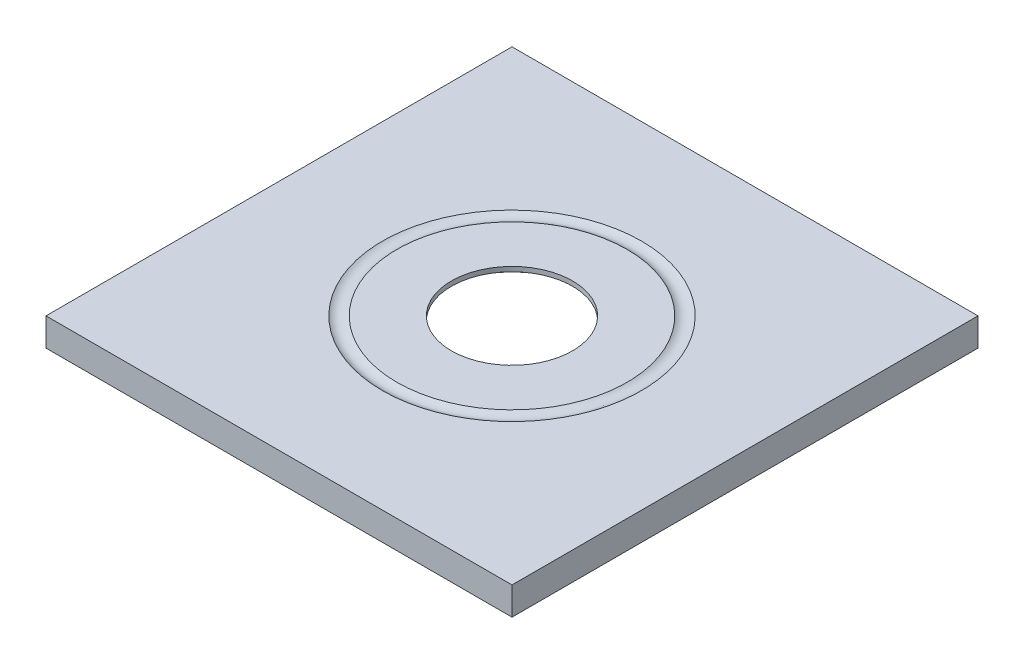
from build123d import *

# Parameters (mm, degrees)
SKETCH2_W           = 200
SKETCH2_H           = 200
SKETCH2_R           = 60
BOSS_EXTRUDE1_DEPTH = 12
BOSS_EXTRUDE2_START = -2
SKETCH3_R           = 40
SKETCH3_R_2         = 26
BOSS_EXTRUDE2_DEPTH = 2


with BuildPart() as part:
    # Sketch1 → Revolve1 (revolve)
    with BuildSketch(Plane(origin=(0, 0, 0), x_dir=(-1, 0, 0), z_dir=(0, 0, -1)), mode=Mode.PRIVATE) as revolve1_sk:
        with BuildLine():
            Line((-40, 4), (-40, -8))
            Line((-40, -8), (-49.4043, -8))
            ThreePointArc((-49.4043, -8), (-52.5, -6.965718833), (-55.5957, -8))
            Line((-55.5957, -8), (-60, -8))
            Line((-60, -8), (-60, 4))
            Line((-60, 4), (-55.5957, 4))
            ThreePointArc((-55.5957, 4), (-52.5, 2.965718833), (-49.4043, 4))
            Line((-49.4043, 4), (-40, 4))
        make_face()
    revolve(revolve1_sk.sketch.rotate(Axis((0, 0, 0), (0, 1, 0)), 270), axis=Axis((0, 0, 0), (0, 1, 0)))

    # Sketch2 → Boss-Extrude1 (add)
    with BuildSketch(Plane(origin=(0, 4, 0), x_dir=(1, 0, 0), z_dir=(0, 1, 0))):
        Rectangle(SKETCH2_W, SKETCH2_H)
        Circle(SKETCH2_R, mode=Mode.SUBTRACT)
    extrude(amount=-BOSS_EXTRUDE1_DEPTH)

    # Sketch3 → Boss-Extrude2 (add)
    with BuildSketch(Plane(origin=(0, 4, 0), x_dir=(1, 0, 0), z_dir=(0, 1, 0)).offset(BOSS_EXTRUDE2_START)):
        with Locations(Location((0, 0, 0), (0, 0, 270))):
            Circle(SKETCH3_R)
        with Locations(Location((0, 0, 0), (0, 0, 270))):
            Circle(SKETCH3_R_2, mode=Mode.SUBTRACT)
    extrude(amount=BOSS_EXTRUDE2_DEPTH)


solid = part.part
